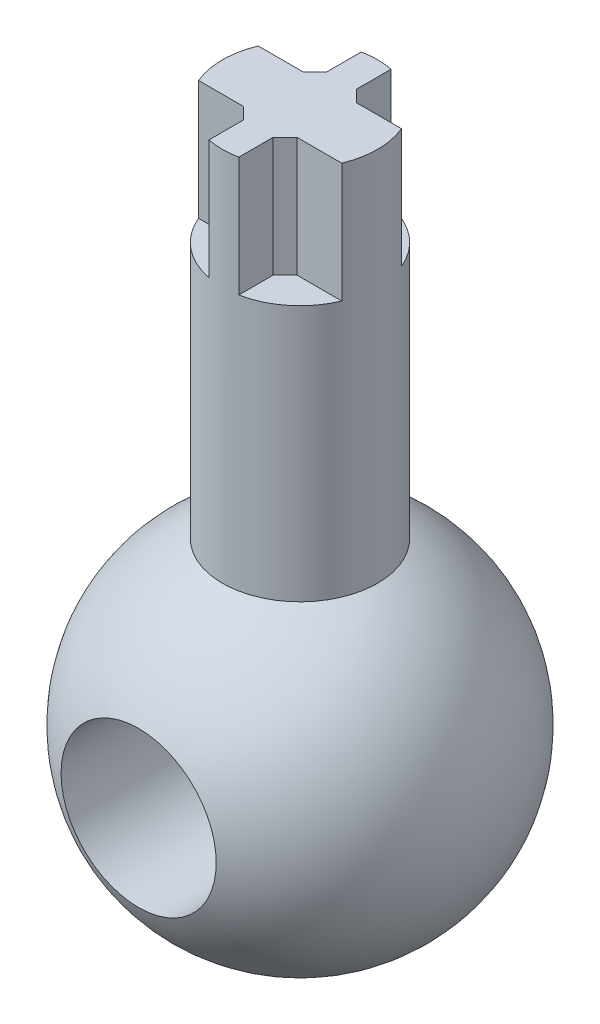
from build123d import *

# Parameters (mm, degrees)
SKETCH_S2_R              = 6.5
EXTRUDE_2_DEPTH          = 45
CUT_EXTRUDE_START        = -10
CUT_EXTRUDE_3_DEPTH      = 10
CHAMFER_4_SIZE           = 1
CUT_EXTRUDE_5_DEPTH      = 50.749371946
CUT_EXTRUDE_5_DEPTH_BACK = 50.749371946
SKETCH_S5_R              = 6.5


with BuildPart() as part:
    # Sketch s1 → Revolve 1 (revolve)
    with BuildSketch(Plane.XY):
        with BuildLine():
            Line((-15, 0), (15, 0))
            ThreePointArc((15, 0), (0, 15), (-15, 0))
        make_face()
    revolve(axis=Axis((-56.6721202, 0, 0), (1, 0, 0)))

    # Sketch s2 → Extrude 2 (add)
    with BuildSketch(Plane(origin=(0, 0, 0), x_dir=(1, 0, 0), z_dir=(0, 1, 0))):
        with Locations(Location((0, 0, 0), (0, 0, 90))):
            Circle(SKETCH_S2_R)
    extrude(amount=EXTRUDE_2_DEPTH)

    # Sketch s3 → Cut-Extrude 3 (cut)
    with BuildSketch(Plane(origin=(0, 45, 0), x_dir=(-1, 0, 0), z_dir=(0, 1, 0)).offset(CUT_EXTRUDE_START)):
        with BuildLine():
            Line((-1.25, -6.378675411), (-1.25, -2.5))
            Line((-1.25, -2.5), (-6, -2.5))
            ThreePointArc((-6, -2.5), (-4.111162334, -5.034713921), (-1.25, -6.378675411))
        make_face()
        with BuildLine():
            Line((1.25, -6.378675411), (1.25, -2.5))
            Line((1.25, -2.5), (6, -2.5))
            ThreePointArc((6, -2.5), (4.111162334, -5.034713921), (1.25, -6.378675411))
        make_face()
        with BuildLine():
            Line((-6, 2.5), (-1.25, 2.5))
            Line((-1.25, 2.5), (-1.25, 6.378675411))
            ThreePointArc((-1.25, 6.378675411), (-4.111162334, 5.034713921), (-6, 2.5))
        make_face()
        with BuildLine():
            Line((1.25, 2.5), (1.25, 6.378675411))
            ThreePointArc((1.25, 6.378675411), (4.111162334, 5.034713921), (6, 2.5))
            Line((6, 2.5), (1.25, 2.5))
        make_face()
    extrude(amount=CUT_EXTRUDE_3_DEPTH, mode=Mode.SUBTRACT)

    # Chamfer 4
    chamfer_4_edges = [part.edges().sort_by_distance(p)[0] for p in [
        (-1.25, 40, -2.5),
        (-1.25, 40, 2.5),
        (1.25, 40, -2.5),
        (1.25, 40, 2.5),
    ]]
    chamfer(chamfer_4_edges, length=CHAMFER_4_SIZE)

    # Sketch s5 → Cut-Extrude 5 (cut, two sides: drawn at the far end of the back side and taken through both)
    with BuildSketch(Plane.XY.offset(-CUT_EXTRUDE_5_DEPTH_BACK)):
        Circle(SKETCH_S5_R)
    extrude(amount=CUT_EXTRUDE_5_DEPTH + CUT_EXTRUDE_5_DEPTH_BACK, mode=Mode.SUBTRACT)


solid = part.part
